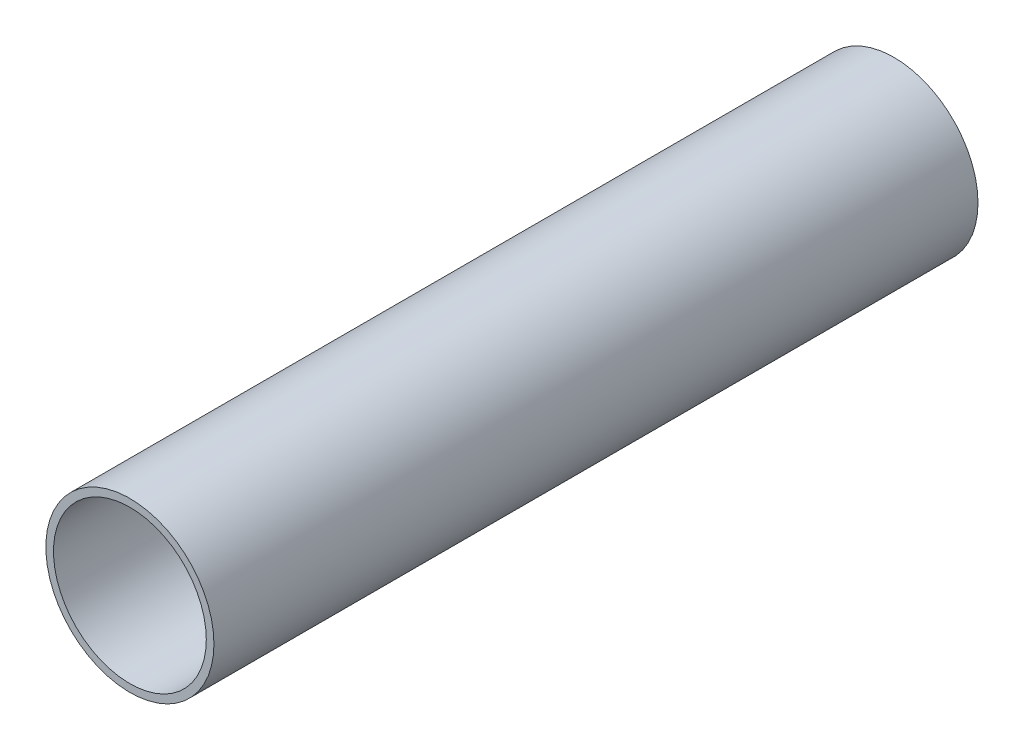
from build123d import *

# Parameters (mm, degrees)
SKETCH_1_R      = 11
SKETCH_1_R_2    = 10
EXTRUDE_1_DEPTH = 100


with BuildPart() as part:
    # 스케치1 → 보스-돌출1 (new body)
    with BuildSketch(Plane.XY):
        Circle(SKETCH_1_R)
        Circle(SKETCH_1_R_2, mode=Mode.SUBTRACT)
    extrude(amount=EXTRUDE_1_DEPTH)


solid = part.part
